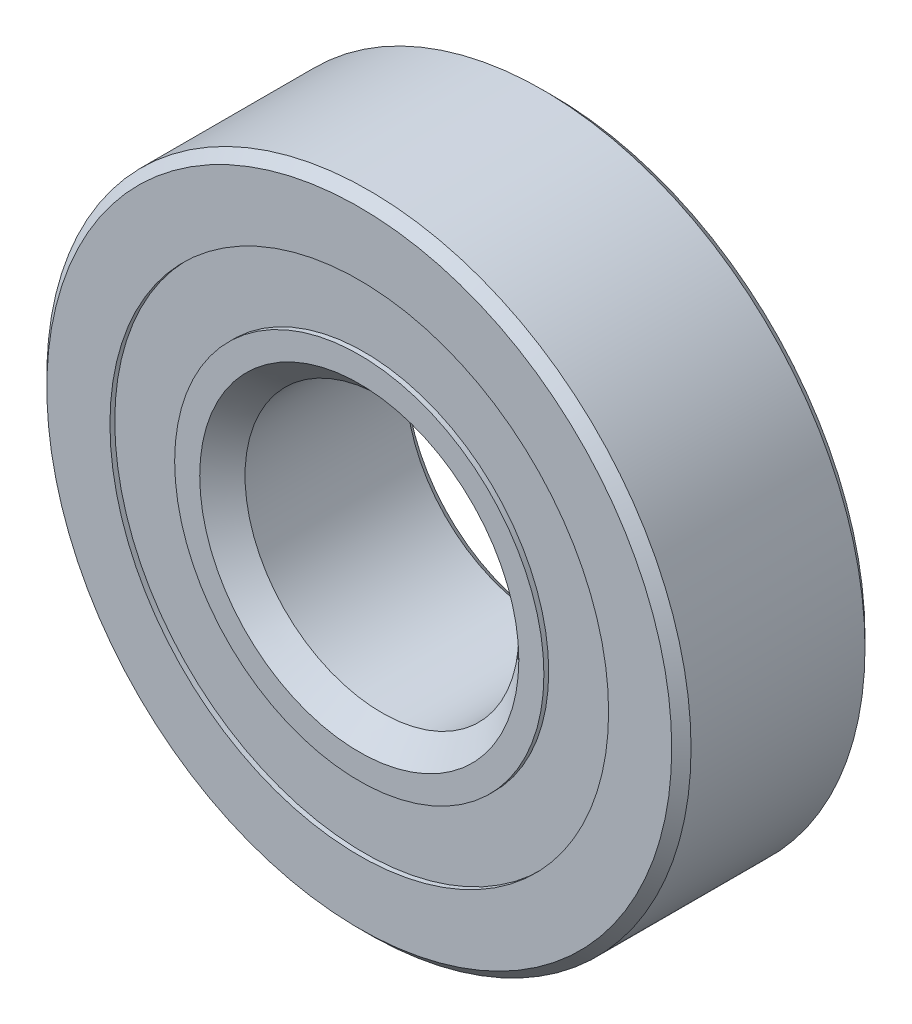
from build123d import *

# Parameters (mm, degrees)
CIRPATTERN1_COUNT = 12
SKETCH5_W         = 2.763011064
SKETCH5_H         = 4.01790108


with BuildPart() as part:
    # Sketch1 → Revolve1 (revolve)
    with BuildSketch(Plane(origin=(0, 0, 0), x_dir=(0, 0, -1), z_dir=(1, 0, 0))):
        with BuildLine():
            Line((5.4, 20), (-5.4, 20))
            Line((-5.4, 20), (-6, 19.4))
            Line((-6, 19.4), (-6, 15.480769231))
            Line((-6, 15.480769231), (-2.666666667, 15.480769231))
            ThreePointArc((-2.666666667, 15.480769231), (0, 17.186988936), (2.666666667, 15.480769231))
            Line((2.666666667, 15.480769231), (6, 15.480769231))
            Line((6, 15.480769231), (6, 19.4))
            Line((6, 19.4), (5.4, 20))
        make_face()
    revolve(axis=Axis((0, 0, 6), (0, 0, -1)))


with BuildPart() as body_2:
    # Sketch3 → Revolve3 (revolve)
    with BuildSketch(Plane(origin=(0, 0, 0), x_dir=(0, 0, -1), z_dir=(1, 0, 0))):
        with BuildLine():
            Line((-5.7, 11.162868151), (-4.443637381, 9.906505532))
            Line((-4.443637381, 9.906505532), (0, 9.906505532))
            Line((0, 9.906505532), (0, 11.313011064))
            ThreePointArc((0, 11.313011064), (1.582900565, 11.776069966), (2.666666667, 13.019230769))
            Line((2.666666667, 13.019230769), (6, 13.019230769))
            Line((6, 13.019230769), (6, 9.1))
            Line((6, 9.1), (5.4, 8.5))
            Line((5.4, 8.5), (-4.593494468, 8.5))
            Line((-4.593494468, 8.5), (-6, 9.906505532))
            Line((-6, 9.906505532), (-6, 11.462868151))
            Line((-6, 11.462868151), (-5.7, 11.462868151))
            Line((-5.7, 11.462868151), (-5.7, 11.162868151))
        make_face()
    revolve(axis=Axis((0, 0, 6), (0, 0, -1)))


with BuildPart() as body_3:
    # Sketch4 → Revolve4 (revolve)
    with BuildSketch(Plane(origin=(0, 0, 0), x_dir=(0, 0, -1), z_dir=(1, 0, 0))):
        with BuildLine():
            Line((-2.936988936, 14.25), (2.936988936, 14.25))
            ThreePointArc((2.936988936, 14.25), (0, 17.186988936), (-2.936988936, 14.25))
        make_face()
    revolve(axis=Axis((0, 14.25, 2.936988936), (0, 0, -1)))


with BuildPart() as cirpattern1_1:
    # CirPattern1: pattern copy
    add(body_3.part.rotate(Axis((0, 0, -6), (0, 0, 1)), 1 * 360 / CIRPATTERN1_COUNT))


with BuildPart() as cirpattern1_2:
    # CirPattern1: pattern copy
    add(body_3.part.rotate(Axis((0, 0, -6), (0, 0, 1)), 2 * 360 / CIRPATTERN1_COUNT))


with BuildPart() as cirpattern1_3:
    # CirPattern1: pattern copy
    add(body_3.part.rotate(Axis((0, 0, -6), (0, 0, 1)), 3 * 360 / CIRPATTERN1_COUNT))


with BuildPart() as cirpattern1_4:
    # CirPattern1: pattern copy
    add(body_3.part.rotate(Axis((0, 0, -6), (0, 0, 1)), 4 * 360 / CIRPATTERN1_COUNT))


with BuildPart() as cirpattern1_5:
    # CirPattern1: pattern copy
    add(body_3.part.rotate(Axis((0, 0, -6), (0, 0, 1)), 5 * 360 / CIRPATTERN1_COUNT))


with BuildPart() as cirpattern1_6:
    # CirPattern1: pattern copy
    add(body_3.part.rotate(Axis((0, 0, -6), (0, 0, 1)), 6 * 360 / CIRPATTERN1_COUNT))


with BuildPart() as cirpattern1_7:
    # CirPattern1: pattern copy
    add(body_3.part.rotate(Axis((0, 0, -6), (0, 0, 1)), 7 * 360 / CIRPATTERN1_COUNT))


with BuildPart() as cirpattern1_8:
    # CirPattern1: pattern copy
    add(body_3.part.rotate(Axis((0, 0, -6), (0, 0, 1)), 8 * 360 / CIRPATTERN1_COUNT))


with BuildPart() as cirpattern1_9:
    # CirPattern1: pattern copy
    add(body_3.part.rotate(Axis((0, 0, -6), (0, 0, 1)), 9 * 360 / CIRPATTERN1_COUNT))


with BuildPart() as cirpattern1_10:
    # CirPattern1: pattern copy
    add(body_3.part.rotate(Axis((0, 0, -6), (0, 0, 1)), 10 * 360 / CIRPATTERN1_COUNT))


with BuildPart() as cirpattern1_11:
    # CirPattern1: pattern copy
    add(body_3.part.rotate(Axis((0, 0, -6), (0, 0, 1)), 11 * 360 / CIRPATTERN1_COUNT))


with BuildPart() as body_15:
    # Sketch5 → Revolve5 (revolve)
    with BuildSketch(Plane(origin=(0, 0, 0), x_dir=(0, 0, -1), z_dir=(1, 0, 0))):
        with Locations((-4.318494468, 13.471818691)):
            Rectangle(SKETCH5_W, SKETCH5_H)
        with Locations((4.318494468, 13.471818691)):
            Rectangle(SKETCH5_W, SKETCH5_H)
    revolve(axis=Axis((0, 0, 6), (0, 0, -1)))


solid = Compound([part.part, body_2.part, body_3.part, cirpattern1_1.part, cirpattern1_2.part, cirpattern1_3.part, cirpattern1_4.part, cirpattern1_5.part, cirpattern1_6.part, cirpattern1_7.part, cirpattern1_8.part, cirpattern1_9.part, cirpattern1_10.part, cirpattern1_11.part, body_15.part])
